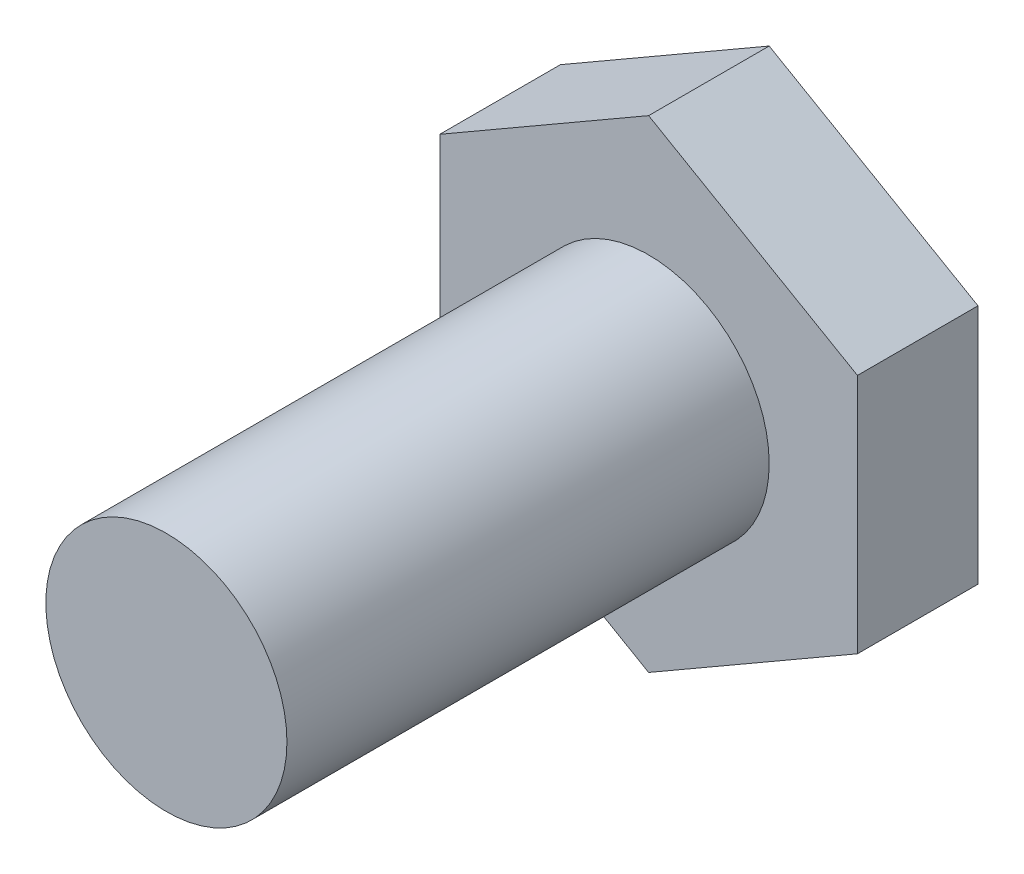
from build123d import *

# Parameters (mm, degrees)
ESQUISSE1_R        = 2
BOSS_EXTRU_1_DEPTH = 8
BOSS_EXTRU_2_DEPTH = 2


with BuildPart() as part:
    # Esquisse1 → Boss.-Extru.1 (new body)
    with BuildSketch(Plane.XY):
        Circle(ESQUISSE1_R)
    extrude(amount=BOSS_EXTRU_1_DEPTH)

    # Esquisse2 → Boss.-Extru.2 (add)
    with BuildSketch(Plane(origin=(0, 0, 0), x_dir=(-1, 0, 0), z_dir=(0, 0, -1))):
        Polygon((0, 4), (-3.464101615, 2), (-3.464101615, -2), (0, -4), (3.464101615, -2), (3.464101615, 2), align=None)
    extrude(amount=BOSS_EXTRU_2_DEPTH)


solid = part.part
